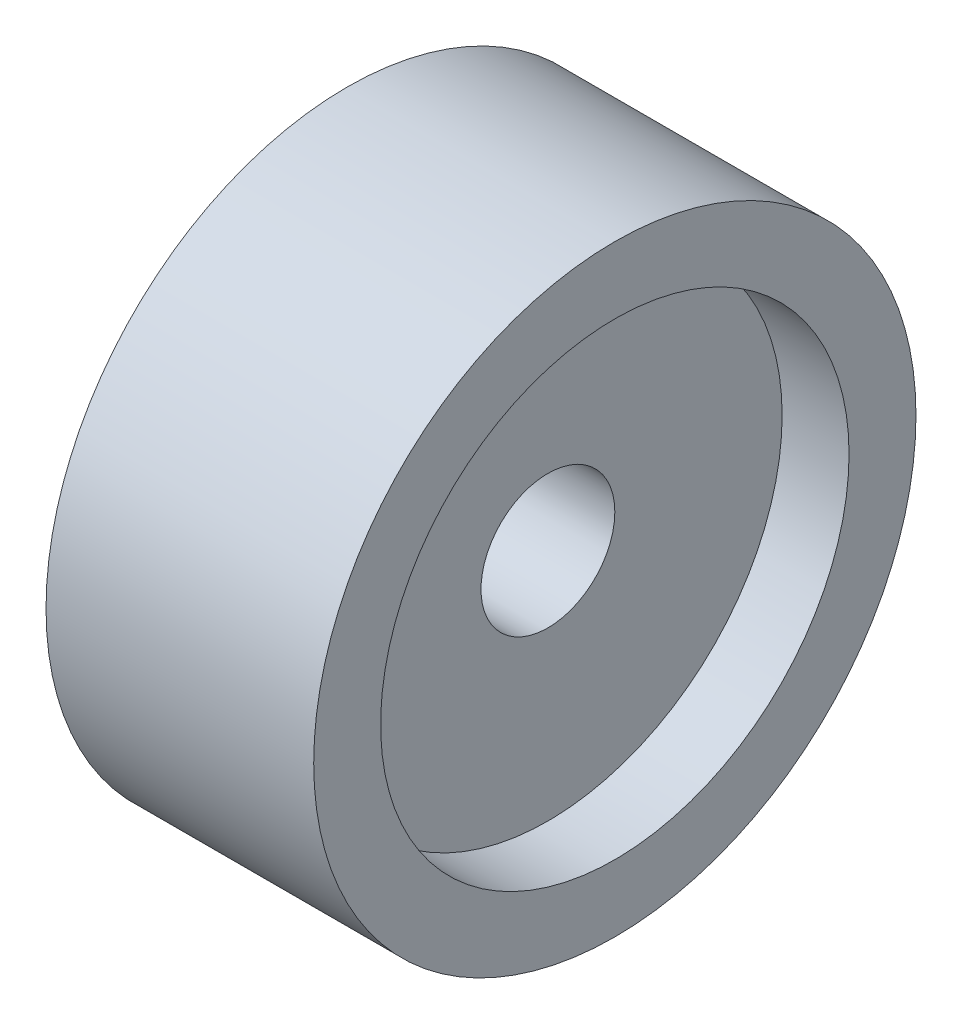
from build123d import *

# Parameters (mm, degrees)
SKETCH3_R                = 200
SKETCH3_R_2              = 50
BOSS_EXTRUDE4_DEPTH      = 100
BOSS_EXTRUDE5_DEPTH      = 50
BOSS_EXTRUDE5_DEPTH_BACK = 150
SKETCH4_R                = 225
SKETCH4_R_2              = 175


with BuildPart() as part:
    # Sketch3 → Boss-Extrude4 (new body)
    with BuildSketch(Plane(origin=(0, 0, 0), x_dir=(0, 0, -1), z_dir=(1, 0, 0))):
        Circle(SKETCH3_R)
        Circle(SKETCH3_R_2, mode=Mode.SUBTRACT)
    extrude(amount=BOSS_EXTRUDE4_DEPTH)

    # Sketch4 → Boss-Extrude5 (add, two sides: drawn at the far end of the back side and taken through both)
    with BuildSketch(Plane(origin=(100, 0, 0), x_dir=(0, 0, -1), z_dir=(1, 0, 0)).offset(-BOSS_EXTRUDE5_DEPTH_BACK)):
        Circle(SKETCH4_R)
        Circle(SKETCH4_R_2, mode=Mode.SUBTRACT)
    extrude(amount=BOSS_EXTRUDE5_DEPTH + BOSS_EXTRUDE5_DEPTH_BACK)


solid = part.part
